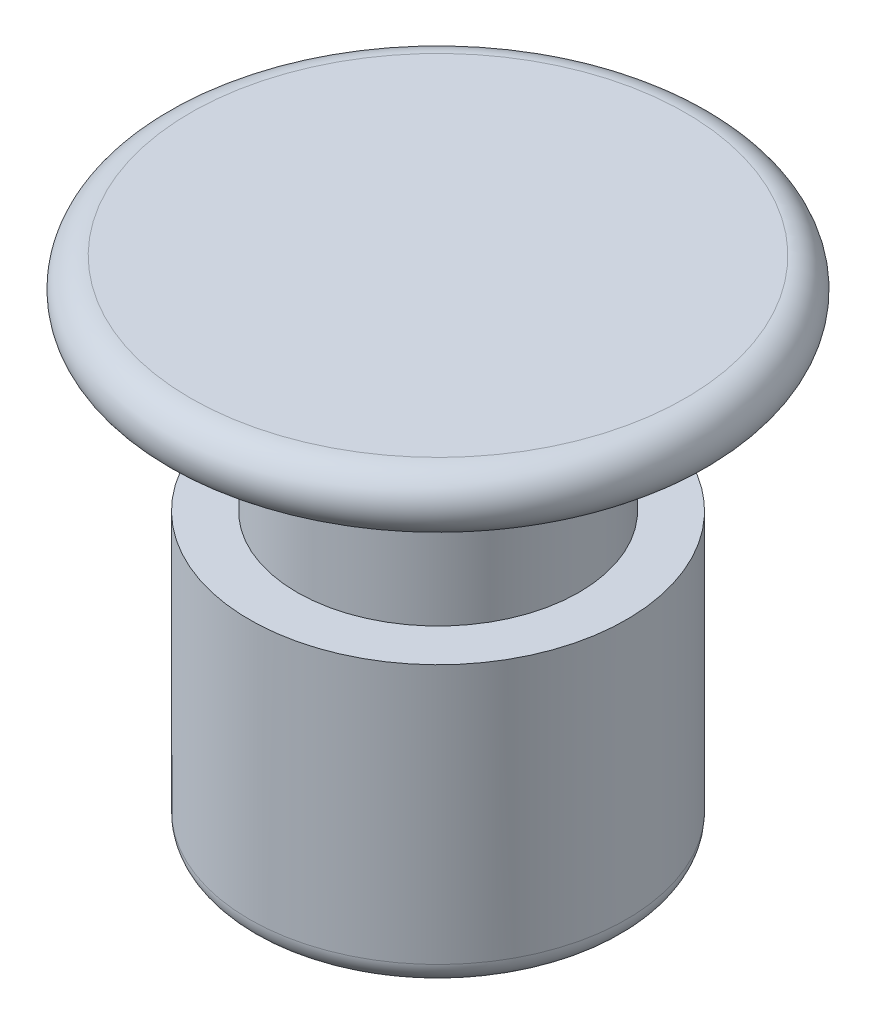
from build123d import *

# Parameters (mm, degrees)
SKETCH3_R           = 2.1209
BOSS_EXTRUDE1_DEPTH = 7.5692
CUT_EXTRUDE1_START  = -11.811
SKETCH5_R           = 2.1209
CUT_EXTRUDE1_DEPTH  = 8.636
FILLET1_R           = 0.254


with BuildPart() as part:
    # Sketch2 → Revolve1 (revolve)
    with BuildSketch(Plane.XY, mode=Mode.PRIVATE) as revolve1_sk:
        with BuildLine():
            Line((1.5875, -1.397), (1.5875, -10.0584))
            Line((1.5875, -10.0584), (0, -10.0584))
            Line((0, -10.0584), (0, 0))
            Line((0, 0), (2.783660204, 0))
            ThreePointArc((2.783660204, 0), (3.10032913, -0.242988613), (2.947580102, -0.611757387))
            Line((2.947580102, -0.611757387), (1.5875, -1.397))
        make_face()
    revolve(revolve1_sk.sketch.rotate(Axis((0, 94.608881441, 0), (0, -1, 0)), 90), axis=Axis((0, 94.608881441, 0), (0, -1, 0)))

    # Sketch3 → Boss-Extrude1 (add)
    with BuildSketch(Plane.XZ.offset(10.0584)):
        with Locations(Location((0, 0, 0), (0, 0, 270))):
            Circle(SKETCH3_R)
    extrude(amount=-BOSS_EXTRUDE1_DEPTH)

    # Sketch5 → Cut-Extrude1 (cut)
    with BuildSketch(Plane(origin=(0, -2.4892, 0), x_dir=(1, 0, 0), z_dir=(0, 1, 0)).offset(CUT_EXTRUDE1_START)):
        with Locations(Location((0, 0, 0), (0, 0, 90))):
            Circle(SKETCH5_R)
    extrude(amount=CUT_EXTRUDE1_DEPTH, mode=Mode.SUBTRACT)

    # Fillet1
    fillet1_edges = [part.edges().sort_by_distance(p)[0] for p in [
        (0, -5.6642, 2.1209),
    ]]
    fillet(fillet1_edges, radius=FILLET1_R)


solid = part.part
